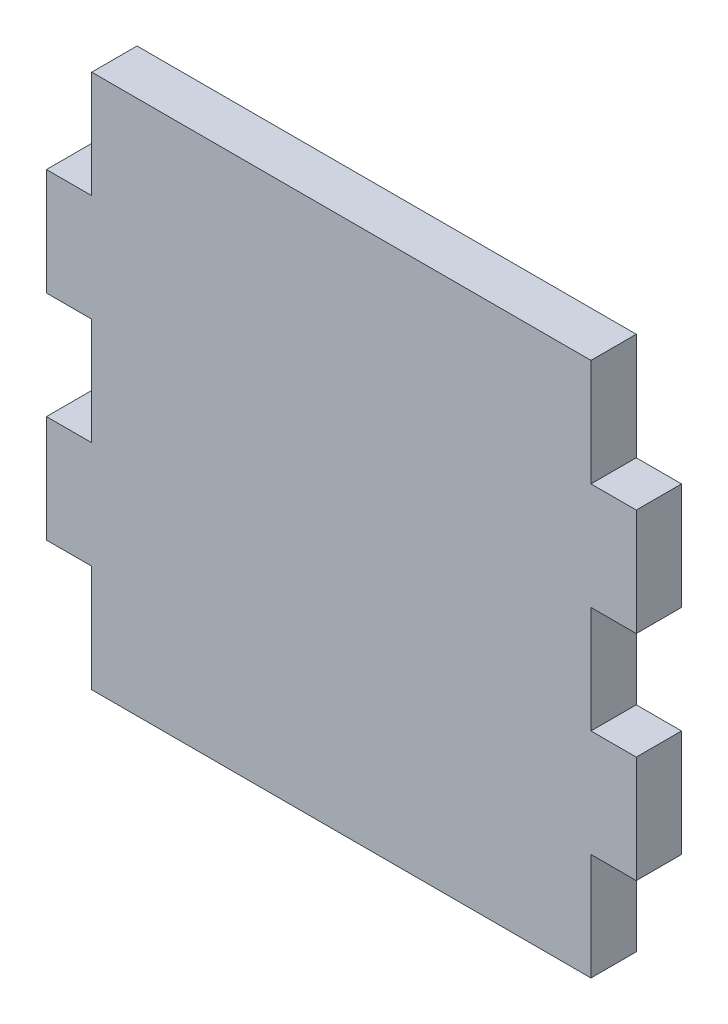
from build123d import *

# Parameters (mm, degrees)
BODY_DEPTH = 6.35


with BuildPart() as part:
    # Sketch1 → Body (new body)
    with BuildSketch(Plane.XY):
        Polygon((-70, 75), (-70, 60), (-76.35, 60), (-76.35, 45), (-70, 45), (-70, 30), (-76.35, 30), (-76.35, 15), (-70, 15), (-70, 0), (0, 0), (0, 15), (6.35, 15), (6.35, 30), (0, 30), (0, 45), (6.35, 45), (6.35, 60), (0, 60), (0, 75), align=None)
    extrude(amount=BODY_DEPTH)


solid = part.part
